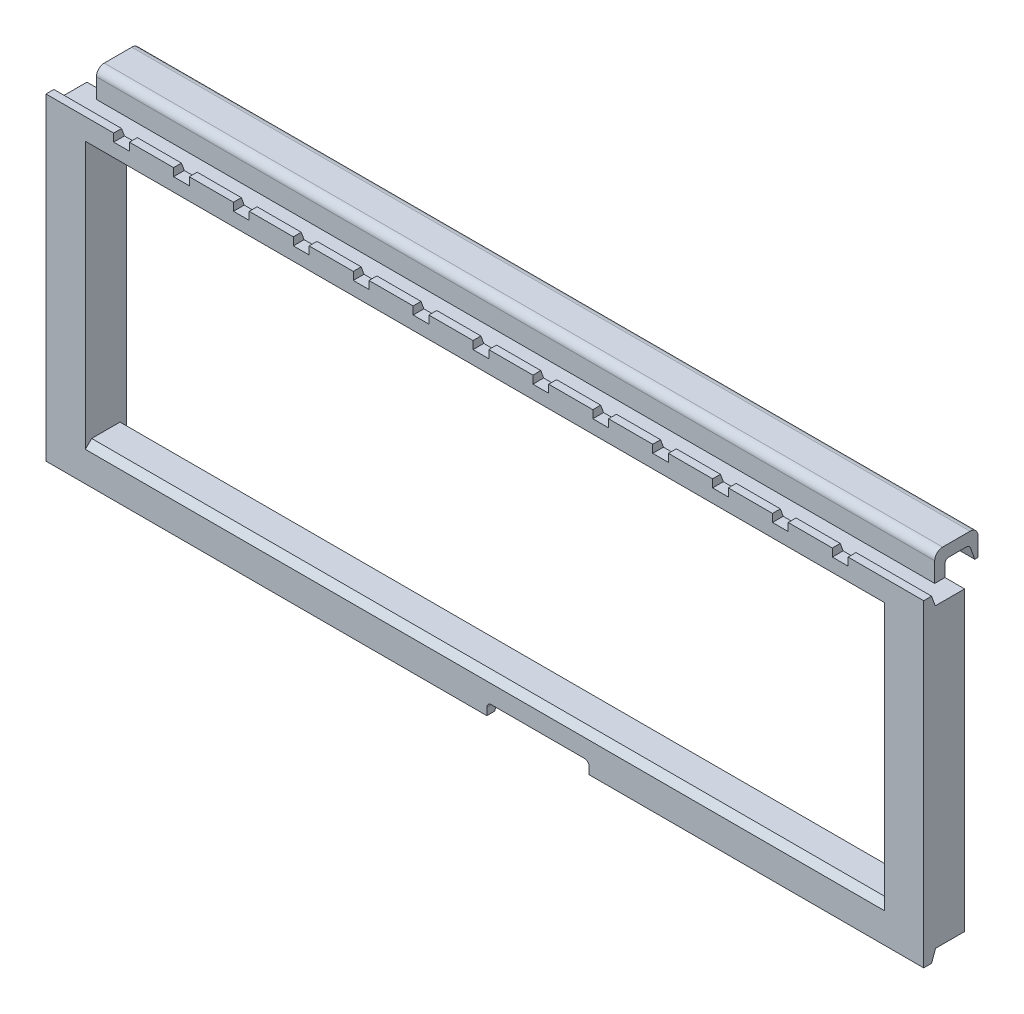
from build123d import *

# Parameters (mm, degrees)
BOSS_EXTRUDE1_DEPTH = 557.5
SKETCH2_W           = 50
SKETCH2_H           = 52
BOSS_EXTRUDE2_DEPTH = 323
BOSS_EXTRUDE3_DEPTH = 1115
SKETCH4_W           = 130
SKETCH4_H           = 15
CUT_EXTRUDE1_DEPTH  = 691.453655215
FILLET1_R           = 6
SKETCH8_W           = 20
SKETCH8_H           = 10
CUT_EXTRUDE3_DEPTH  = 691.453655215
SKETCH10_W          = 1065
SKETCH10_H          = 35
BOSS_EXTRUDE7_DEPTH = 13
BOSS_EXTRUDE8_DEPTH = 532.5
FILLET3_R           = 10
FILLET4_R           = 5
CHAMFER1_SIZE       = 8


with BuildPart() as part:
    # Sketch1 → Boss-Extrude1 (new, symmetric)
    with BuildSketch(Plane(origin=(0, 0, 0), x_dir=(0, 0, -1), z_dir=(1, 0, 0))):
        Polygon((0, 0), (0, 46), (52, 46), (52, 14), (15.09558328, 14), (10, 0), align=None)
    extrude(amount=BOSS_EXTRUDE1_DEPTH, both=True)

    # Sketch2 → Boss-Extrude2 (add)
    with BuildSketch(Plane(origin=(0, 46, 0), x_dir=(1, 0, 0), z_dir=(0, 1, 0))):
        with Locations((-532.5, 26)):
            Rectangle(SKETCH2_W, SKETCH2_H)
        with Locations((532.5, 26)):
            Rectangle(SKETCH2_W, SKETCH2_H)
    extrude(amount=BOSS_EXTRUDE2_DEPTH)

    # Sketch3 → Boss-Extrude3 (add)
    with BuildSketch(Plane(origin=(557.5, 0, 0), x_dir=(0, 0, -1), z_dir=(1, 0, 0))):
        Polygon((0, 369), (0, 404), (10, 404), (14.731613045, 391), (52, 391), (52, 369), align=None)
    extrude(amount=-BOSS_EXTRUDE3_DEPTH)

    # Sketch4 → Cut-Extrude1 (cut, through all)
    with BuildSketch(Plane.XY):
        with Locations((67.5, 7.5)):
            Rectangle(SKETCH4_W, SKETCH4_H)
    extrude(amount=-CUT_EXTRUDE1_DEPTH, mode=Mode.SUBTRACT)

    # Fillet1
    fillet1_edges = [part.edges().sort_by_distance(p)[0] for p in [
        (132.5, 15, -26),
        (2.5, 15, -26),
    ]]
    fillet(fillet1_edges, radius=FILLET1_R)

    # Sketch8 → Cut-Extrude3 (cut, through all)
    with BuildSketch(Plane.XY):
        with Locations((-461.5, 399)):
            Rectangle(SKETCH8_W, SKETCH8_H)
        with Locations((-385.416666667, 399)):
            Rectangle(SKETCH8_W, SKETCH8_H)
        with Locations((-309.333333333, 399)):
            Rectangle(SKETCH8_W, SKETCH8_H)
        with Locations((-233.25, 399)):
            Rectangle(SKETCH8_W, SKETCH8_H)
        with Locations((-157.166666667, 399)):
            Rectangle(SKETCH8_W, SKETCH8_H)
        with Locations((-81.083333333, 399)):
            Rectangle(SKETCH8_W, SKETCH8_H)
        with Locations((-5, 399)):
            Rectangle(SKETCH8_W, SKETCH8_H)
        with Locations((71.083333333, 399)):
            Rectangle(SKETCH8_W, SKETCH8_H)
        with Locations((147.166666667, 399)):
            Rectangle(SKETCH8_W, SKETCH8_H)
        with Locations((223.25, 399)):
            Rectangle(SKETCH8_W, SKETCH8_H)
        with Locations((299.333333333, 399)):
            Rectangle(SKETCH8_W, SKETCH8_H)
        with Locations((375.416666667, 399)):
            Rectangle(SKETCH8_W, SKETCH8_H)
        with Locations((451.5, 399)):
            Rectangle(SKETCH8_W, SKETCH8_H)
    extrude(amount=-CUT_EXTRUDE3_DEPTH, mode=Mode.SUBTRACT)

    # Sketch10 → Boss-Extrude7 (add)
    with BuildSketch(Plane(origin=(0, 0, -52), x_dir=(-1, 0, 0), z_dir=(0, 0, -1))):
        with Locations((0, 408.5)):
            Rectangle(SKETCH10_W, SKETCH10_H)
    extrude(amount=-BOSS_EXTRUDE7_DEPTH)

    # Sketch11 → Boss-Extrude8 (add, symmetric)
    with BuildSketch(Plane(origin=(0, 0, 0), x_dir=(0, 0, -1), z_dir=(1, 0, 0))):
        Polygon((39, 426), (94, 426), (94, 392), (90, 392), (83.084565549, 411), (39, 411), align=None)
    extrude(amount=BOSS_EXTRUDE8_DEPTH, both=True)

    # Fillet3
    fillet3_edges = [part.edges().sort_by_distance(p)[0] for p in [
        (0, 426, -39),
        (0, 426, -94),
    ]]
    fillet(fillet3_edges, radius=FILLET3_R)

    # Fillet4
    fillet4_edges = [part.edges().sort_by_distance(p)[0] for p in [
        (0, 411, -52),
        (0, 411, -83.084565549),
    ]]
    fillet(fillet4_edges, radius=FILLET4_R)

    # Chamfer1
    chamfer1_edges = [part.edges().sort_by_distance(p)[0] for p in [
        (0, 46, 0),
        (0, 46, -52),
        (0, 369, -52),
        (0, 369, 0),
    ]]
    chamfer(chamfer1_edges, length=CHAMFER1_SIZE)


solid = part.part
